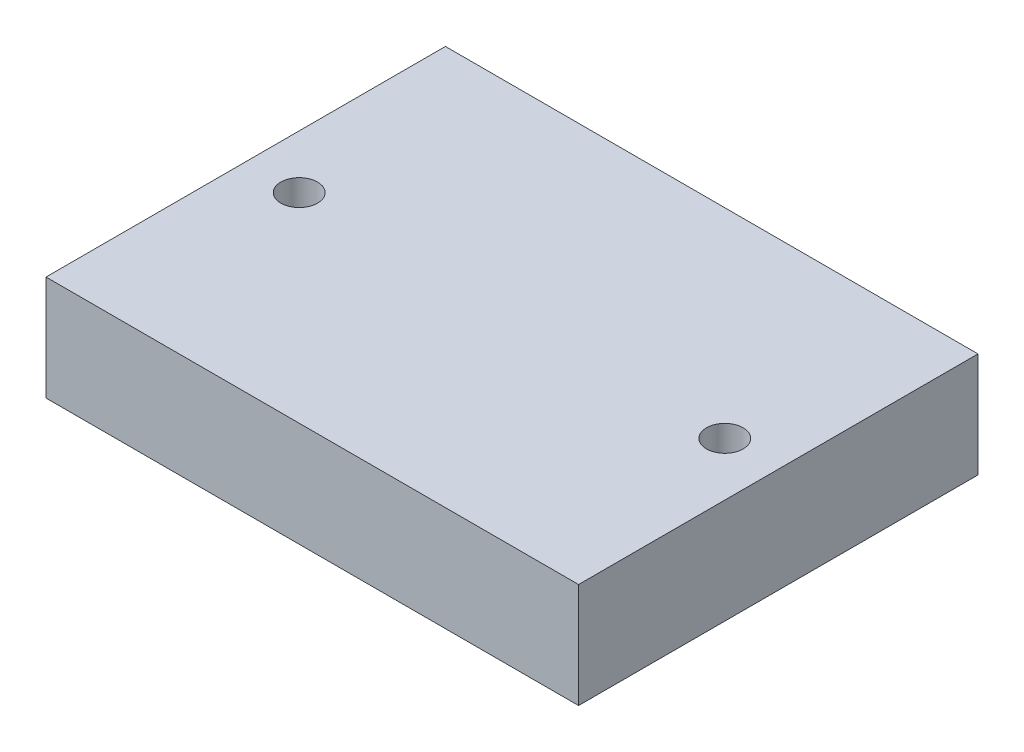
from build123d import *

# Parameters (mm, degrees)
SKETCH1_W           = 50.8
SKETCH1_H           = 38.1
SKETCH1_R           = 1.75
BOSS_EXTRUDE1_DEPTH = 10


with BuildPart() as part:
    # Sketch1 → Boss-Extrude1 (new body)
    with BuildSketch(Plane(origin=(0, 0, 0), x_dir=(1, 0, 0), z_dir=(0, 1, 0))):
        with Locations((25.4, 19.05)):
            Rectangle(SKETCH1_W, SKETCH1_H)
        with Locations(Location((5.1, 19.05, 0), (0, 0, 270))):
            Circle(SKETCH1_R, mode=Mode.SUBTRACT)
        with Locations(Location((45.7, 19.05, 0), (0, 0, 270))):
            Circle(SKETCH1_R, mode=Mode.SUBTRACT)
    extrude(amount=BOSS_EXTRUDE1_DEPTH)


solid = part.part
